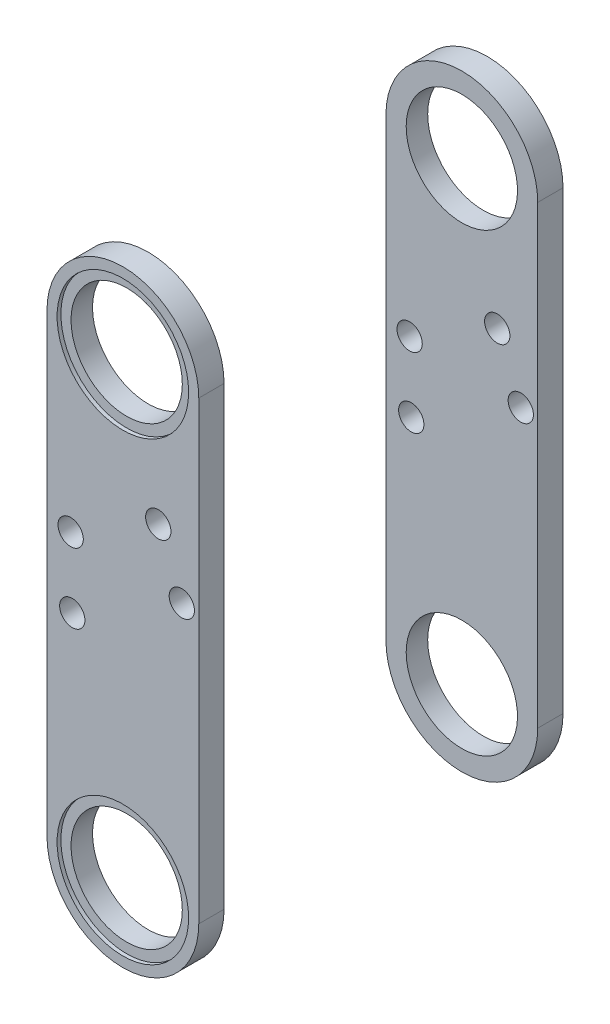
from build123d import *

# Parameters (mm, degrees)
SKETCH_1_R               = 11
EXTRUDE_1_DEPTH          = 72
SKETCH_2_W               = 62
SKETCH_2_H               = 70
SKETCH_2_H_2             = 67.94057246
CUT_EXTRUDE_1_DEPTH      = 70
EXTRUDE_2_DEPTH          = 62
EXTRUDE_3_DEPTH          = 62
CUT_EXTRUDE_3_DEPTH      = 130.811063026
CUT_EXTRUDE_3_DEPTH_BACK = 130.811063026
SKETCH_6_R               = 2.5
CUT_EXTRUDE_4_DEPTH      = 136.359998088
CUT_EXTRUDE_4_DEPTH_BACK = 136.359998088
SKETCH_7_W               = 62
SKETCH_7_H               = 120
SKETCH_8_R               = 13
CUT_EXTRUDE_5_DEPTH      = 0.75
SKETCH_9_R               = 13
CUT_EXTRUDE_6_DEPTH      = 0.75
SKETCH_12_R              = 13
CUT_EXTRUDE_7_DEPTH      = 0.75
SKETCH_13_R              = 13
CUT_EXTRUDE_8_DEPTH      = 0.75


with BuildPart() as part:
    # 草图1 → 凸台-拉伸1 (new body)
    with BuildSketch(Plane.XY):
        with BuildLine():
            Line((-15, 90), (-15, 0))
            ThreePointArc((-15, 0), (0, -15), (15, 0))
            Line((15, 0), (15, 90))
            ThreePointArc((15, 90), (0, 105), (-15, 90))
        make_face()
        Circle(SKETCH_1_R, mode=Mode.SUBTRACT)
        with Locations((0, 90)):
            Circle(SKETCH_1_R, mode=Mode.SUBTRACT)
    extrude(amount=EXTRUDE_1_DEPTH)

    # 草图2 → 切除-拉伸1 (cut)
    with BuildSketch(Plane.ZY.offset(15)):
        with Locations((36, 80)):
            Rectangle(SKETCH_2_W, SKETCH_2_H)
        with Locations((36, 11.02971377)):
            Rectangle(SKETCH_2_W, SKETCH_2_H_2)
    extrude(amount=-CUT_EXTRUDE_1_DEPTH, mode=Mode.SUBTRACT)


with BuildPart() as cut_extrude_1_piece_1:
    # of the separate pieces the step leaves, piece 1, a body of its own (cut_extrude_1_pieces)
    add(part.part.solids().sort_by_distance((15, 0, 0))[0])



with BuildPart() as cut_extrude_1_piece_2:
    # of the separate pieces the step leaves, piece 2, a body of its own (cut_extrude_1_pieces)
    add(part.part.solids().sort_by_distance((15, 0, 67))[0])


with BuildPart() as cut_extrude_1_piece_1_1:
    add(cut_extrude_1_piece_1.part)

    add(cut_extrude_1_piece_2.part)  # 凸台-拉伸2 merges 切除-拉伸1 piece 2
    # 草图4 → 凸台-拉伸2 (add)
    with BuildSketch(Plane(origin=(0, 0, 67), x_dir=(-1, 0, 0), z_dir=(0, 0, -1))):
        with BuildLine():
            Line((-4.490156776, 68.758657712), (15, 57.50601045))
            Line((15, 57.50601045), (36.319312502, 12.911360415))
            ThreePointArc((36.319312502, 12.911360415), (35.142094618, 9.577570071), (31.808304274, 10.754787955))
            Line((31.808304274, 10.754787955), (15, 45.913541163))
            Line((15, 45.913541163), (-9.509843224, 60.064305746))
            ThreePointArc((-9.509843224, 60.064305746), (-11.347175983, 66.921324953), (-4.490156776, 68.758657712))
        make_face()
    extrude(amount=EXTRUDE_2_DEPTH)

    # 草图5 → 凸台-拉伸3 (add)
    with BuildSketch(Plane(origin=(0, 0, 67), x_dir=(-1, 0, 0), z_dir=(0, 0, -1))):
        with BuildLine():
            Line((-30.017605928, 49.094069219), (-15, 60.919508718))
            Line((-15, 60.919508718), (12.5, 45.042376315))
            ThreePointArc((12.5, 45.042376315), (14.330127019, 38.212249296), (7.5, 36.382122277))
            Line((7.5, 36.382122277), (-15, 49.372503334))
            Line((-15, 49.372503334), (-27.615908762, 44.780688066))
            ThreePointArc((-27.615908762, 44.780688066), (-30.655195979, 45.913733224), (-30.017605928, 49.094069219))
        make_face()
    extrude(amount=EXTRUDE_3_DEPTH)

    # 草图6 → 切除-拉伸3 (cut, two sides: drawn at the far end of the back side and taken through both)
    with BuildSketch(Plane(origin=(0, 0, 67), x_dir=(-1, 0, 0), z_dir=(0, 0, -1)).offset(-CUT_EXTRUDE_3_DEPTH_BACK)):
        with Locations(Location((-7, 64.411481729, 0), (0, 0, 90))):
            Circle(SKETCH_6_R)
        with Locations(Location((-11.650635095, 53.212249296, 0), (0, 0, 90))):
            Circle(SKETCH_6_R)
        with Locations(Location((10, 40.712249296, 0), (0, 0, 90))):
            Circle(SKETCH_6_R)
        with Locations(Location((10.320508076, 54.411481729, 0), (0, 0, 90))):
            Circle(SKETCH_6_R)
    extrude(amount=CUT_EXTRUDE_3_DEPTH + CUT_EXTRUDE_3_DEPTH_BACK, mode=Mode.SUBTRACT)

    # 草图7 → 切除-拉伸4 (cut, two sides: drawn at the far end of the back side and taken through both)
    with BuildSketch(Plane.ZY.offset(15).offset(-CUT_EXTRUDE_4_DEPTH_BACK)):
        with Locations((36, 45)):
            Rectangle(SKETCH_7_W, SKETCH_7_H)
    extrude(amount=CUT_EXTRUDE_4_DEPTH + CUT_EXTRUDE_4_DEPTH_BACK, mode=Mode.SUBTRACT)


with BuildPart() as cut_extrude_4_piece_1:
    # of the separate pieces the step leaves, piece 1, a body of its own (cut_extrude_4_pieces)
    add(cut_extrude_1_piece_1_1.part.solids().sort_by_distance((-15, 90, 5))[0])

    # 草图9 → 切除-拉伸6 (cut)
    with BuildSketch(Plane(origin=(0, 0, 0), x_dir=(-1, 0, 0), z_dir=(0, 0, -1))):
        Circle(SKETCH_9_R)
    extrude(amount=-CUT_EXTRUDE_6_DEPTH, mode=Mode.SUBTRACT)

    # 草图13 → 切除-拉伸8 (cut)
    with BuildSketch(Plane(origin=(0, 0, 0), x_dir=(-1, 0, 0), z_dir=(0, 0, -1))):
        with Locations((0, 90)):
            Circle(SKETCH_13_R)
    extrude(amount=-CUT_EXTRUDE_8_DEPTH, mode=Mode.SUBTRACT)


with BuildPart() as cut_extrude_4_piece_2:
    # of the separate pieces the step leaves, piece 2, a body of its own (cut_extrude_4_pieces)
    add(cut_extrude_1_piece_1_1.part.solids().sort_by_distance((15, 0, 67))[0])

    # 草图8 → 切除-拉伸5 (cut)
    with BuildSketch(Plane.XY.offset(72)):
        Circle(SKETCH_8_R)
    extrude(amount=-CUT_EXTRUDE_5_DEPTH, mode=Mode.SUBTRACT)

    # 草图12 → 切除-拉伸7 (cut)
    with BuildSketch(Plane.XY.offset(72)):
        with Locations((0, 90)):
            Circle(SKETCH_12_R)
    extrude(amount=-CUT_EXTRUDE_7_DEPTH, mode=Mode.SUBTRACT)


solid = Compound([cut_extrude_4_piece_1.part, cut_extrude_4_piece_2.part])
